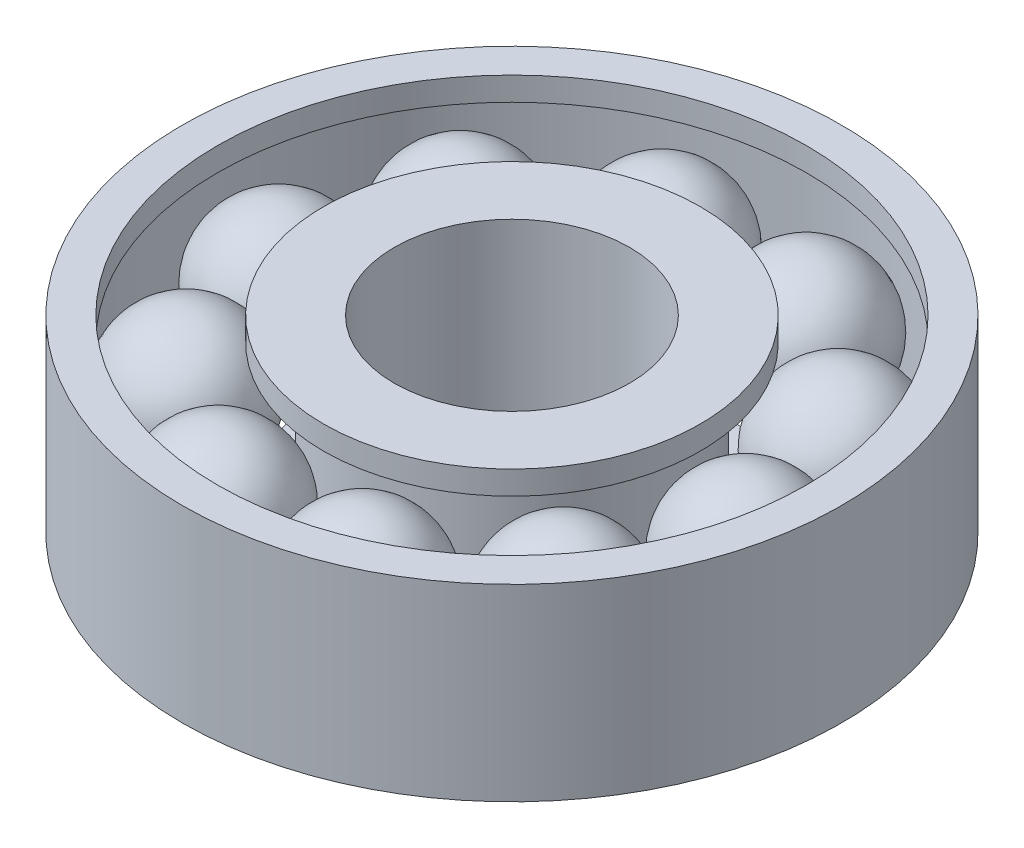
from build123d import *

# Parameters (mm, degrees)
BOSS_EXTRUDE1_START = 3
SKETCH2_R           = 14
SKETCH2_R_2         = 12.5
BOSS_EXTRUDE1_DEPTH = 8
BOSS_EXTRUDE2_START = 3
SKETCH5_R           = 8
SKETCH5_R_2         = 5
BOSS_EXTRUDE2_DEPTH = 8
SKETCH3_W           = 6.75
SKETCH3_H           = 6
CIRPATTERN4_COUNT   = 10


with BuildPart() as part:
    # Sketch2 → Boss-Extrude1 (new body)
    with BuildSketch(Plane(origin=(0, 0, 0), x_dir=(1, 0, 0), z_dir=(0, 1, 0)).offset(BOSS_EXTRUDE1_START)):
        with Locations(Location((0, 0, 0), (0, 0, 270))):
            Circle(SKETCH2_R)
        with Locations(Location((0, 0, 0), (0, 0, 270))):
            Circle(SKETCH2_R_2, mode=Mode.SUBTRACT)
    extrude(amount=BOSS_EXTRUDE1_DEPTH)


with BuildPart() as body_2:
    # Sketch5 → Boss-Extrude2 (new body)
    with BuildSketch(Plane(origin=(0, 0, 0), x_dir=(1, 0, 0), z_dir=(0, 1, 0)).offset(BOSS_EXTRUDE2_START)):
        with Locations(Location((0, 0, 0), (0, 0, 270))):
            Circle(SKETCH5_R)
        with Locations(Location((0, 0, 0), (0, 0, 270))):
            Circle(SKETCH5_R_2, mode=Mode.SUBTRACT)
    extrude(amount=BOSS_EXTRUDE2_DEPTH)


with BuildPart() as cut_revolve1_tool:
    # Sketch3 → Cut-Revolve1 (revolve)
    with BuildSketch(Plane.XY):
        with Locations((-9.875, 7)):
            Rectangle(SKETCH3_W, SKETCH3_H)
    revolve(axis=Axis((0, 11, 0), (0, -1, 0)))


with BuildPart() as part_1:
    add(part.part)

    # Cut-Revolve1: cut by cut_revolve1_tool
    add(cut_revolve1_tool.part, mode=Mode.SUBTRACT)


with BuildPart() as body_2_1:
    add(body_2.part)

    # Cut-Revolve1: cut by cut_revolve1_tool
    add(cut_revolve1_tool.part, mode=Mode.SUBTRACT)


with BuildPart() as body_3:
    # Sketch6 → Revolve4 (revolve)
    with BuildSketch(Plane.XY):
        with BuildLine():
            Line((9.91273612, 10.20884205), (9.91273612, 4.20884205))
            ThreePointArc((9.91273612, 4.20884205), (12.91273612, 7.20884205), (9.91273612, 10.20884205))
        make_face()
    revolve(axis=Axis((9.91273612, 11, 0), (0, -1, 0)))


with BuildPart() as cirpattern4_1:
    # CirPattern4: pattern copy
    add(body_3.part.rotate(Axis((0, 0, 0), (0, 1, 0)), 1 * 360 / CIRPATTERN4_COUNT))


with BuildPart() as cirpattern4_2:
    # CirPattern4: pattern copy
    add(body_3.part.rotate(Axis((0, 0, 0), (0, 1, 0)), 2 * 360 / CIRPATTERN4_COUNT))


with BuildPart() as cirpattern4_3:
    # CirPattern4: pattern copy
    add(body_3.part.rotate(Axis((0, 0, 0), (0, 1, 0)), 3 * 360 / CIRPATTERN4_COUNT))


with BuildPart() as cirpattern4_4:
    # CirPattern4: pattern copy
    add(body_3.part.rotate(Axis((0, 0, 0), (0, 1, 0)), 4 * 360 / CIRPATTERN4_COUNT))


with BuildPart() as cirpattern4_5:
    # CirPattern4: pattern copy
    add(body_3.part.rotate(Axis((0, 0, 0), (0, 1, 0)), 5 * 360 / CIRPATTERN4_COUNT))


with BuildPart() as cirpattern4_6:
    # CirPattern4: pattern copy
    add(body_3.part.rotate(Axis((0, 0, 0), (0, 1, 0)), 6 * 360 / CIRPATTERN4_COUNT))


with BuildPart() as cirpattern4_7:
    # CirPattern4: pattern copy
    add(body_3.part.rotate(Axis((0, 0, 0), (0, 1, 0)), 7 * 360 / CIRPATTERN4_COUNT))


with BuildPart() as cirpattern4_8:
    # CirPattern4: pattern copy
    add(body_3.part.rotate(Axis((0, 0, 0), (0, 1, 0)), 8 * 360 / CIRPATTERN4_COUNT))


with BuildPart() as cirpattern4_9:
    # CirPattern4: pattern copy
    add(body_3.part.rotate(Axis((0, 0, 0), (0, 1, 0)), 9 * 360 / CIRPATTERN4_COUNT))


solid = Compound([part_1.part, body_2_1.part, body_3.part, cirpattern4_1.part, cirpattern4_2.part, cirpattern4_3.part, cirpattern4_4.part, cirpattern4_5.part, cirpattern4_6.part, cirpattern4_7.part, cirpattern4_8.part, cirpattern4_9.part])
